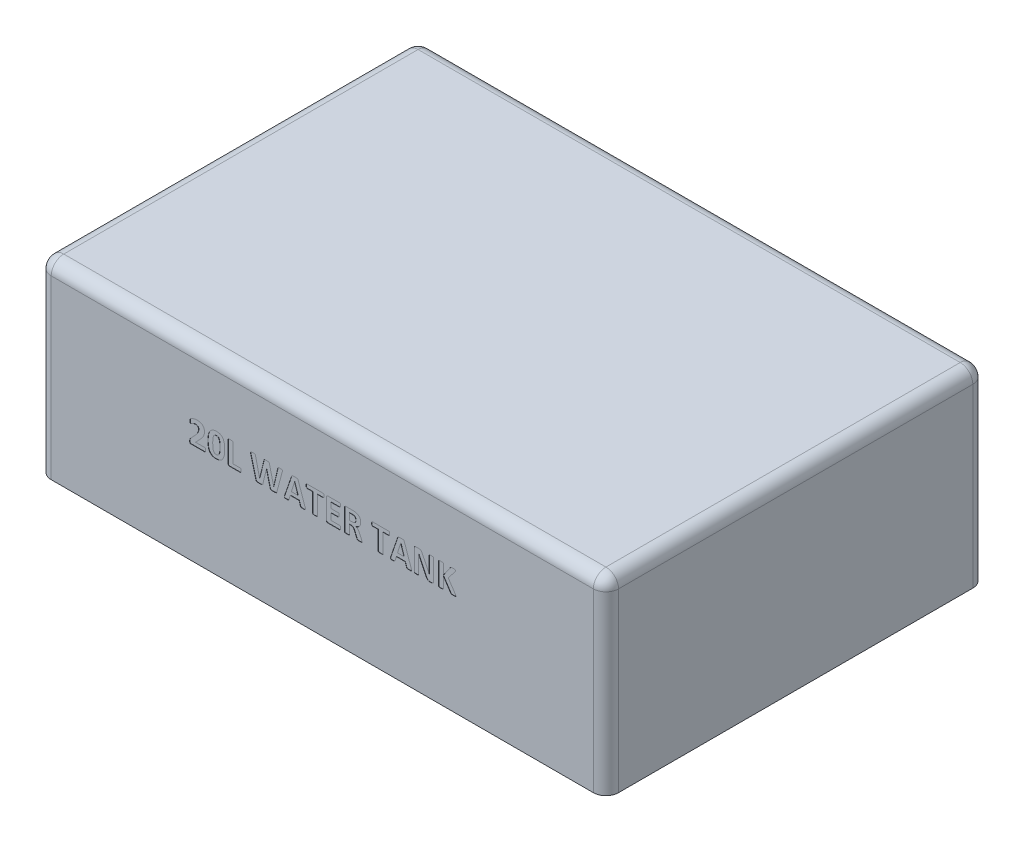
from build123d import *

# Parameters (mm, degrees)
SKETCH1_W           = 450
SKETCH1_H           = 300
BOSS_EXTRUDE1_DEPTH = 150
SKETCH6_W           = 450
SKETCH6_H           = 150
BOSS_EXTRUDE3_DEPTH = 1
CUT_EXTRUDE4_DEPTH  = 0.2
FILLET2_R           = 10


with BuildPart() as part:
    # Sketch1 → Boss-Extrude1 (new body)
    with BuildSketch(Plane(origin=(0, 0, 0), x_dir=(1, 0, 0), z_dir=(0, 1, 0))):
        Rectangle(SKETCH1_W, SKETCH1_H)
    extrude(amount=BOSS_EXTRUDE1_DEPTH)

    # Sketch6 → Boss-Extrude3 (add)
    with BuildSketch(Plane.XY.offset(150)):
        with Locations((0, 75)):
            Rectangle(SKETCH6_W, SKETCH6_H)
    extrude(amount=BOSS_EXTRUDE3_DEPTH)

    # Sketch7 → Cut-Extrude4 (cut)
    # profile 1 of 12: a face of its own
    with BuildSketch(Plane.XY.offset(151)):
        with BuildLine():
            add(Edge.make_bspline(
                [(-92.604166667, 81.506519991), (-92.60480363, 81.380135507), (-92.605979556, 81.146811364), (-92.638697416, 80.826192291), (-92.675039957, 80.559220559), (-92.73986537, 80.347915517), (-92.815393638, 80.181080844), (-92.92803015, 80.071795686), (-93.058861874, 80.014000144), (-93.149806715, 80.004696089), (-93.195709827, 80)],
                knots=[0, 0, 0, 0, 1.700477232, 3.139328327, 4.338937117, 5.31779253, 6.112293145, 6.774269824, 7.381330181, 8, 8, 8, 8], degree=3))
            Line((-93.195709827, 80), (-103.932856541, 80))
            add(Edge.make_bspline(
                [(-103.932856541, 80), (-104.032250538, 80.002068616), (-104.217935337, 80.005933142), (-104.477314553, 80.043518436), (-104.697058847, 80.128532112), (-104.875680521, 80.272830381), (-105.000659463, 80.488351757), (-105.083321584, 80.771882474), (-105.124010024, 81.135122808), (-105.129774354, 81.404304472), (-105.132965686, 81.553332759)],
                knots=[0, 0, 0, 0, 1.025949817, 1.916647791, 2.69162005, 3.43032923, 4.23901448, 5.220859075, 6.461371377, 8, 8, 8, 8], degree=3))
            add(Edge.make_bspline(
                [(-105.132965686, 81.553332759), (-105.129971468, 81.698053375), (-105.124445459, 81.965143951), (-105.098664553, 82.338663618), (-105.040258231, 82.660821638), (-104.944714973, 82.947984933), (-104.807070432, 83.207613385), (-104.646867855, 83.468762035), (-104.434825562, 83.730981757), (-104.274340433, 83.906274309), (-104.188198912, 84.000363817)],
                knots=[0, 0, 0, 0, 1.279770231, 2.361892714, 3.306414937, 4.167028953, 5.025172171, 5.898575693, 6.872045744, 8, 8, 8, 8], degree=3))
            Line((-104.188198912, 84.000363817), (-101.034720627, 87.387905944))
            add(Edge.make_bspline(
                [(-101.034720627, 87.387905944), (-100.884868047, 87.551649768), (-100.595086413, 87.868293986), (-100.190428172, 88.339630062), (-99.832953705, 88.789885379), (-99.520452452, 89.218089729), (-99.245262459, 89.625670122), (-99.005216501, 90.013970696), (-98.792782517, 90.383271425), (-98.561624321, 90.839819049), (-98.338219085, 91.376940413), (-98.163040733, 91.993368853), (-98.071254349, 92.565626764), (-98.057903293, 92.934232122), (-98.051470588, 93.111830767)],
                knots=[0, 0, 0, 0, 1.20947157, 2.338849612, 3.384319872, 4.341377303, 5.226828348, 6.063423144, 6.828539773, 7.547598628, 8.851019864, 9.991402106, 11.032232556, 12, 12, 12, 12], degree=3))
            add(Edge.make_bspline(
                [(-98.051470588, 93.111830767), (-98.059009048, 93.254418213), (-98.073942523, 93.536879897), (-98.187407947, 93.943130168), (-98.370232144, 94.316993078), (-98.635490272, 94.638780939), (-98.969198037, 94.91103637), (-99.383724506, 95.104957552), (-99.871215064, 95.232206245), (-100.222393746, 95.24542301), (-100.409131817, 95.25245098)],
                knots=[0, 0, 0, 0, 0.952592796, 1.887059298, 2.799298945, 3.716508085, 4.654435942, 5.655858967, 6.753510967, 8, 8, 8, 8], degree=3))
            add(Edge.make_bspline(
                [(-100.409131817, 95.25245098), (-100.545391142, 95.250045978), (-100.80996807, 95.245376147), (-101.195979847, 95.207899388), (-101.556838889, 95.138963349), (-101.996321619, 95.02183174), (-102.490632293, 94.838848551), (-103.016530166, 94.592635798), (-103.4610082, 94.34402625), (-103.781381682, 94.150744777), (-103.994583746, 94.010336466), (-104.133644618, 93.948853501), (-104.251549617, 93.899135174), (-104.328268537, 93.893260322), (-104.362682866, 93.890625)],
                knots=[0, 0, 0, 0, 1.155956231, 2.244538859, 3.28550842, 4.269318886, 6.100628768, 7.748195433, 9.191883973, 10.417953324, 10.925724687, 11.351067817, 11.708904068, 12, 12, 12, 12], degree=3))
            add(Edge.make_bspline(
                [(-104.362682866, 93.890625), (-104.403504868, 93.894276355), (-104.485725093, 93.901630607), (-104.59586215, 93.98044169), (-104.682019584, 94.107573093), (-104.742684534, 94.292851983), (-104.790475838, 94.538703348), (-104.833282912, 94.854048568), (-104.856579837, 95.24359789), (-104.859183038, 95.527623997), (-104.86060049, 95.682277305)],
                knots=[0, 0, 0, 0, 0.485692822, 0.97824142, 1.565816375, 2.311318477, 3.305989244, 4.581102635, 6.138397226, 8, 8, 8, 8], degree=3))
            add(Edge.make_bspline(
                [(-104.86060049, 95.682277305), (-104.86054146, 95.787298294), (-104.860434467, 95.977652661), (-104.841757483, 96.240239649), (-104.818675302, 96.45963364), (-104.780393041, 96.646504183), (-104.729079007, 96.806323981), (-104.661869136, 96.954985376), (-104.554003144, 97.103217089), (-104.431953606, 97.23712937), (-104.290188366, 97.355890492), (-104.141643896, 97.46013012), (-103.956490768, 97.576870997), (-103.641145757, 97.745785996), (-103.17475212, 97.972624358), (-102.526476842, 98.217840526), (-101.789417061, 98.444868039), (-100.979379016, 98.637294649), (-100.112645611, 98.770268656), (-99.515930316, 98.785482248), (-99.213278378, 98.793198529)],
                knots=[0, 0, 0, 0, 0.788292368, 1.428808632, 1.975788089, 2.443732868, 2.858052408, 3.234493626, 3.66294862, 4.228288178, 4.591069522, 5.049213324, 5.590039132, 6.233559628, 7.734267659, 9.480939635, 11.431700141, 13.521863135, 15.728704436, 18, 18, 18, 18], degree=3))
            add(Edge.make_bspline(
                [(-99.213278378, 98.793198529), (-98.977610285, 98.789755981), (-98.520821661, 98.783083389), (-97.857786595, 98.713361395), (-97.240454844, 98.601997991), (-96.670499213, 98.43769848), (-96.146527094, 98.238472427), (-95.665725916, 98.005318769), (-95.233852974, 97.731748046), (-94.847511238, 97.422991622), (-94.507193217, 97.083753717), (-94.211871692, 96.711578697), (-93.966876542, 96.307515424), (-93.765075455, 95.875241342), (-93.613698367, 95.418818539), (-93.503798304, 94.945851686), (-93.431658372, 94.456004188), (-93.424766738, 94.123528604), (-93.421262255, 93.954460593)],
                knots=[0, 0, 0, 0, 1.324900052, 2.568015312, 3.744666331, 4.8481595, 5.898614886, 6.894039723, 7.847934722, 8.767415271, 9.669989851, 10.544631889, 11.43259769, 12.321315746, 13.221949113, 14.131442766, 15.049815173, 16, 16, 16, 16], degree=3))
            add(Edge.make_bspline(
                [(-93.421262255, 93.954460593), (-93.429592097, 93.654726564), (-93.446209016, 93.056797367), (-93.554898838, 92.311952716), (-93.692128929, 91.714122645), (-93.851293196, 91.252514385), (-94.044779485, 90.769694979), (-94.296174737, 90.271894354), (-94.591766131, 89.748530912), (-94.94161458, 89.200523044), (-95.347110384, 88.626046651), (-95.811441118, 88.022539174), (-96.339573796, 87.378547151), (-96.944226184, 86.690212358), (-97.631126746, 85.955046569), (-98.120015693, 85.453466695), (-98.374904259, 85.19196155)],
                knots=[0, 0, 0, 0, 1.214695824, 2.423155294, 3.043825433, 3.698462194, 4.400034292, 5.150962269, 5.956941602, 6.835925221, 7.785176393, 8.806499493, 9.921972916, 11.160753287, 12.51972206, 14, 14, 14, 14], degree=3))
            Line((-98.374904259, 85.19196155), (-100.502757353, 82.996017157))
            Line((-100.502757353, 82.996017157), (-93.242522595, 82.996017157))
            add(Edge.make_bspline(
                [(-93.242522595, 82.996017157), (-93.196247126, 82.992092878), (-93.103322726, 82.984212649), (-92.974516492, 82.911857498), (-92.856312918, 82.804166794), (-92.763966629, 82.641598765), (-92.686272594, 82.434133457), (-92.641745976, 82.170385955), (-92.605279529, 81.856517384), (-92.604555067, 81.62867269), (-92.604166667, 81.506519991)],
                knots=[0, 0, 0, 0, 0.620001289, 1.24500623, 1.94939785, 2.757032326, 3.738367869, 4.928457297, 6.353276405, 8, 8, 8, 8], degree=3))
        make_face()
    # profile 2 of 12: a face of its own
    with BuildSketch(Plane.XY.offset(151)):
        with BuildLine():
            add(Edge.make_bspline(
                [(-77.351715686, 89.332763672), (-77.355292965, 88.973756866), (-77.362270577, 88.273500919), (-77.431284596, 87.249337534), (-77.545945492, 86.279369886), (-77.700262262, 85.363163277), (-77.905193429, 84.504751616), (-78.173994756, 83.710275145), (-78.496418658, 82.979617457), (-78.874075313, 82.314277265), (-79.316830133, 81.722183454), (-79.815502961, 81.196394958), (-80.384155335, 80.752154024), (-81.011625843, 80.376813691), (-81.706844942, 80.081514131), (-82.475375734, 79.873350349), (-83.315714406, 79.751278445), (-83.900832017, 79.735693795), (-84.20340265, 79.727634804)],
                knots=[0, 0, 0, 0, 1.280142505, 2.496964928, 3.658445283, 4.762089533, 5.808699902, 6.802158264, 7.748814871, 8.653008089, 9.524146816, 10.379274413, 11.229404425, 12.089188086, 12.979964829, 13.913938538, 14.921275101, 16, 16, 16, 16], degree=3))
            add(Edge.make_bspline(
                [(-84.20340265, 79.727634804), (-84.510195366, 79.735875353), (-85.097899508, 79.751661272), (-85.939739459, 79.868863928), (-86.697845504, 80.071662404), (-87.376638972, 80.354954444), (-87.981549863, 80.714892767), (-88.510399241, 81.156720942), (-88.987946277, 81.656352866), (-89.386203493, 82.239463811), (-89.728147099, 82.887088926), (-90.01007163, 83.602046907), (-90.247618215, 84.380899002), (-90.415484614, 85.228624944), (-90.539929366, 86.137245137), (-90.633585446, 87.102580073), (-90.689385003, 88.12631361), (-90.694818416, 88.827681984), (-90.697610294, 89.188069661)],
                knots=[0, 0, 0, 0, 1.116564975, 2.138935591, 3.085931557, 3.965362537, 4.808430945, 5.637530691, 6.466775146, 7.316224023, 8.198621357, 9.127780993, 10.109559384, 11.158728965, 12.269463774, 13.447127443, 14.688244517, 16, 16, 16, 16], degree=3))
            add(Edge.make_bspline(
                [(-90.697610294, 89.188069661), (-90.694745775, 89.545717375), (-90.68915818, 90.243352799), (-90.610169514, 91.263787968), (-90.50636612, 92.233728006), (-90.3440321, 93.150667505), (-90.134530905, 94.011065427), (-89.868906891, 94.80850502), (-89.543395423, 95.538047612), (-89.165306174, 96.20254439), (-88.725629828, 96.799879671), (-88.220833316, 97.322897618), (-87.652674166, 97.768935645), (-87.024854916, 98.143930422), (-86.329745929, 98.439414298), (-85.563850692, 98.646438267), (-84.728034588, 98.769979319), (-84.147098815, 98.785270894), (-83.84592333, 98.793198529)],
                knots=[0, 0, 0, 0, 1.275935792, 2.488868156, 3.650539398, 4.755790181, 5.809222936, 6.808140458, 7.750805295, 8.655602092, 9.531384403, 10.390594486, 11.241291987, 12.101649582, 12.993020947, 13.927618113, 14.925611662, 16, 16, 16, 16], degree=3))
            add(Edge.make_bspline(
                [(-83.84592333, 98.793198529), (-83.538998324, 98.787388301), (-82.949374852, 98.776226464), (-82.107955801, 98.64915571), (-81.344376034, 98.455301876), (-80.665024706, 98.164980258), (-80.057153717, 97.805398433), (-79.519129901, 97.371404846), (-79.050690211, 96.862591519), (-78.649626301, 96.281964585), (-78.309237426, 95.633389337), (-78.024056741, 94.920383678), (-77.800295496, 94.138224087), (-77.629035222, 93.292446228), (-77.503981637, 92.383778056), (-77.417291267, 91.417987754), (-77.359516446, 90.394555662), (-77.354363467, 89.693163547), (-77.351715686, 89.332763672)],
                knots=[0, 0, 0, 0, 1.1154279, 2.142811628, 3.087698179, 3.973172265, 4.819981724, 5.64914424, 6.477969577, 7.326725871, 8.20840376, 9.136805822, 10.114848545, 11.163162705, 12.272991897, 13.449208879, 14.689314032, 16, 16, 16, 16], degree=3))
        make_face()
        with BuildLine():
            add(Edge.make_bspline(
                [(-81.164828431, 89.141256893), (-81.165742861, 89.352623595), (-81.167510528, 89.761212792), (-81.178307669, 90.355825717), (-81.206660042, 90.910318846), (-81.233261497, 91.429983022), (-81.276886576, 91.913733181), (-81.327717667, 92.36495737), (-81.384932223, 92.782943722), (-81.481111837, 93.277651617), (-81.605933458, 93.829392363), (-81.815951397, 94.401705936), (-82.056906927, 94.876283264), (-82.364218689, 95.238388715), (-82.709223363, 95.513982536), (-83.107339291, 95.683254044), (-83.541425805, 95.784083369), (-83.845319639, 95.79269973), (-84.003384459, 95.797181373)],
                knots=[0, 0, 0, 0, 1.252656067, 2.421487074, 3.523945301, 4.542880805, 5.504947389, 6.401770782, 7.23401126, 8.00401156, 9.388497809, 10.580084833, 11.61067594, 12.523473101, 13.374357542, 14.202341007, 15.064980546, 16, 16, 16, 16], degree=3))
            add(Edge.make_bspline(
                [(-84.003384459, 95.797181373), (-84.140033892, 95.792911757), (-84.402898354, 95.784698549), (-84.777778415, 95.704244033), (-85.120511459, 95.584616676), (-85.421453935, 95.40006151), (-85.692464032, 95.170745968), (-85.924437945, 94.884291929), (-86.135529061, 94.554304064), (-86.312613832, 94.172816043), (-86.459643798, 93.742399675), (-86.587551592, 93.264905251), (-86.688224038, 92.735689916), (-86.762575604, 92.157098739), (-86.816885772, 91.529434575), (-86.853080461, 90.852368547), (-86.88032982, 90.125960888), (-86.883079994, 89.625016949), (-86.884497549, 89.366809321)],
                knots=[0, 0, 0, 0, 0.830406459, 1.597403976, 2.323929485, 3.028688112, 3.73286484, 4.474568648, 5.262512747, 6.112128818, 7.026802286, 8.027809387, 9.118195914, 10.302553145, 11.576589742, 12.951469302, 14.428658737, 16, 16, 16, 16], degree=3))
            add(Edge.make_bspline(
                [(-86.884497549, 89.366809321), (-86.883293608, 89.054704452), (-86.88099455, 88.458705881), (-86.852169577, 87.607101342), (-86.800237543, 86.839495639), (-86.736576795, 86.1515182), (-86.642220867, 85.539465533), (-86.528949417, 84.99614519), (-86.393887501, 84.517748096), (-86.239267302, 84.100875626), (-86.055031669, 83.745983289), (-85.845975441, 83.449449415), (-85.614619068, 83.20485095), (-85.354266209, 83.017767013), (-85.065476697, 82.884753604), (-84.753813414, 82.794271166), (-84.417381062, 82.729813991), (-84.183872838, 82.725754124), (-84.062964346, 82.723651961)],
                knots=[0, 0, 0, 0, 1.85321902, 3.538925519, 5.058498589, 6.421342315, 7.640056482, 8.733733654, 9.714903156, 10.58939389, 11.369318339, 12.082176755, 12.737469836, 13.359260972, 13.973474606, 14.615698241, 15.283220796, 16, 16, 16, 16], degree=3))
            add(Edge.make_bspline(
                [(-84.062964346, 82.723651961), (-83.884695592, 82.730518513), (-83.543958733, 82.74364301), (-83.063129909, 82.87950322), (-82.642482767, 83.104182512), (-82.285070571, 83.428875398), (-81.981409903, 83.837589547), (-81.740720751, 84.341307026), (-81.544692473, 84.92518079), (-81.388517279, 85.595019581), (-81.275800215, 86.352144808), (-81.207921605, 87.200934629), (-81.171723412, 88.140832104), (-81.167194661, 88.7979296), (-81.164828431, 89.141256893)],
                knots=[0, 0, 0, 0, 0.812198358, 1.552408438, 2.25954763, 2.970620909, 3.738781613, 4.570097942, 5.508197261, 6.546623335, 7.706294858, 8.999891258, 10.432471252, 12, 12, 12, 12], degree=3))
        make_face(mode=Mode.SUBTRACT)
    # profile 3 of 12: a face of its own
    with BuildSketch(Plane.XY.offset(151)):
        with BuildLine():
            add(Edge.make_bspline(
                [(-64.278186275, 81.519287109), (-64.278928563, 81.392928103), (-64.280298936, 81.159650998), (-64.311523415, 80.841525222), (-64.350992457, 80.576816769), (-64.413246568, 80.364508761), (-64.491276754, 80.1958832), (-64.595399097, 80.077098321), (-64.724651742, 80.012562427), (-64.815182668, 80.004234689), (-64.861218022, 80)],
                knots=[0, 0, 0, 0, 1.69995762, 3.138369049, 4.299922826, 5.296754232, 6.108045987, 6.783725302, 7.381519227, 8, 8, 8, 8], degree=3))
            Line((-64.861218022, 80), (-73.491790173, 80))
            add(Edge.make_bspline(
                [(-73.491790173, 80), (-73.568615033, 80.0032405), (-73.718394128, 80.009558236), (-73.934904204, 80.059654879), (-74.127985618, 80.153637203), (-74.307757038, 80.270458327), (-74.455919353, 80.435785373), (-74.559529412, 80.648941463), (-74.616311729, 80.903547957), (-74.62399636, 81.086338095), (-74.628063725, 81.18308632)],
                knots=[0, 0, 0, 0, 0.988206998, 1.926625728, 2.832905899, 3.739002297, 4.669579943, 5.648984647, 6.755640938, 8, 8, 8, 8], degree=3))
            Line((-74.628063725, 81.18308632), (-74.628063725, 97.920778761))
            add(Edge.make_bspline(
                [(-74.628063725, 97.920778761), (-74.62272286, 97.967100087), (-74.612091754, 98.059303664), (-74.535227222, 98.188450752), (-74.404385379, 98.298572281), (-74.205950491, 98.374395286), (-73.946906337, 98.435580675), (-73.61245543, 98.485957606), (-73.195982104, 98.519472102), (-72.888979782, 98.520352868), (-72.721507353, 98.520833333)],
                knots=[0, 0, 0, 0, 0.51358715, 1.022306066, 1.626293916, 2.38232859, 3.357940148, 4.587254232, 6.138317588, 8, 8, 8, 8], degree=3))
            add(Edge.make_bspline(
                [(-72.721507353, 98.520833333), (-72.551180005, 98.520517817), (-72.242723106, 98.519946427), (-71.82499355, 98.485464964), (-71.492986428, 98.436381491), (-71.236069347, 98.373541498), (-71.037971296, 98.298945463), (-70.90901023, 98.187062643), (-70.824774649, 98.061023365), (-70.818213168, 97.967350382), (-70.81495098, 97.920778761)],
                knots=[0, 0, 0, 0, 1.891840835, 3.426057895, 4.654471675, 5.614083843, 6.369564826, 6.973110337, 7.489458814, 8, 8, 8, 8], degree=3))
            Line((-70.81495098, 97.920778761), (-70.81495098, 82.996017157))
            Line((-70.81495098, 82.996017157), (-64.861218022, 82.996017157))
            add(Edge.make_bspline(
                [(-64.861218022, 82.996017157), (-64.814928523, 82.993901019), (-64.724983755, 82.989789168), (-64.60195438, 82.921318098), (-64.495984801, 82.815558922), (-64.418062977, 82.656654627), (-64.347502446, 82.454855803), (-64.31287561, 82.193846489), (-64.279732417, 81.877640544), (-64.278731658, 81.645692149), (-64.278186275, 81.519287109)],
                knots=[0, 0, 0, 0, 0.628853991, 1.221921344, 1.883771067, 2.660348459, 3.628496149, 4.814630856, 6.264067687, 8, 8, 8, 8], degree=3))
        make_face()
    # profile 4 of 12: a face of its own
    with BuildSketch(Plane.XY.offset(151)):
        with BuildLine():
            add(Edge.make_bspline(
                [(-36.016041475, 81.034136604), (-36.046561685, 80.930851948), (-36.102821938, 80.740459392), (-36.23510775, 80.484073628), (-36.43844476, 80.292549453), (-36.712589829, 80.160888965), (-37.061592029, 80.077395308), (-37.496868644, 80.024527729), (-38.037318327, 80.004625082), (-38.434703222, 80.001647512), (-38.654579312, 80)],
                knots=[0, 0, 0, 0, 0.828472167, 1.527186518, 2.191185698, 2.938119969, 3.840992575, 4.941785944, 6.307866865, 8, 8, 8, 8], degree=3))
            add(Edge.make_bspline(
                [(-38.654579312, 80), (-38.782241915, 80.001684512), (-39.024802525, 80.004885107), (-39.369707642, 80.005340504), (-39.674510812, 80.021572671), (-40.011949862, 80.033085384), (-40.361173991, 80.076838268), (-40.708344999, 80.158305418), (-40.970436474, 80.291552018), (-41.151284466, 80.487834362), (-41.265022888, 80.742203329), (-41.310726351, 80.931051336), (-41.335674211, 81.034136604)],
                knots=[0, 0, 0, 0, 1.200390798, 2.280758157, 3.241844714, 4.069696988, 5.454290943, 6.544491945, 7.409847109, 8.174247725, 9.003388151, 10, 10, 10, 10], degree=3))
            Line((-41.335674211, 81.034136604), (-44.229554419, 92.664981618))
            Line((-44.229554419, 92.664981618), (-44.259344363, 92.664981618))
            Line((-44.259344363, 92.664981618), (-47.123434628, 81.034136604))
            add(Edge.make_bspline(
                [(-47.123434628, 81.034136604), (-47.148328165, 80.935140152), (-47.194916855, 80.749866561), (-47.313944152, 80.501375051), (-47.492483014, 80.298553441), (-47.756955017, 80.164614386), (-48.101096853, 80.074727993), (-48.448667581, 80.033252448), (-48.781744435, 80.021719378), (-49.083725866, 80.005167488), (-49.424376087, 80.004951697), (-49.665518204, 80.001701541), (-49.791762408, 80)],
                knots=[0, 0, 0, 0, 0.964606664, 1.805278237, 2.584746217, 3.474186178, 4.562364076, 5.943010412, 6.776466711, 7.71722888, 8.804909628, 10, 10, 10, 10], degree=3))
            add(Edge.make_bspline(
                [(-49.791762408, 80), (-49.925099633, 80.001682929), (-50.176172674, 80.004851873), (-50.532417849, 80.00535816), (-50.845745678, 80.021609065), (-51.191639705, 80.032994562), (-51.548177207, 80.076129056), (-51.901421589, 80.159654763), (-52.170188548, 80.290131148), (-52.356698698, 80.487272292), (-52.473489636, 80.742969753), (-52.528101732, 80.931190564), (-52.557971431, 81.034136604)],
                knots=[0, 0, 0, 0, 1.226427643, 2.309354474, 3.275578471, 4.111462609, 5.491790153, 6.570859358, 7.440377765, 8.197066898, 9.013898509, 10, 10, 10, 10], degree=3))
            Line((-52.557971431, 81.034136604), (-56.788143382, 97.044103286))
            add(Edge.make_bspline(
                [(-56.788143382, 97.044103286), (-56.80698719, 97.124874479), (-56.842265984, 97.276091803), (-56.885951247, 97.490152842), (-56.915059731, 97.676456824), (-56.941436471, 97.877309795), (-56.924657882, 98.101351755), (-56.798366711, 98.274744732), (-56.661090362, 98.371957046), (-56.524509773, 98.42335023), (-56.361485271, 98.46217032), (-56.168726469, 98.48536373), (-55.940038745, 98.501086209), (-55.673304078, 98.515011677), (-55.366722317, 98.516112539), (-55.149690523, 98.519199222), (-55.034792433, 98.520833333)],
                knots=[0, 0, 0, 0, 1.131713364, 2.118758674, 2.981202209, 3.70160486, 4.892526967, 5.934423668, 6.503746327, 7.172352893, 7.90946648, 8.788265191, 9.817133147, 11.038040768, 12.431918871, 14, 14, 14, 14], degree=3))
            add(Edge.make_bspline(
                [(-55.034792433, 98.520833333), (-54.928399124, 98.521104737), (-54.72553212, 98.521622241), (-54.440348743, 98.518188162), (-54.189272705, 98.508213238), (-53.918059883, 98.498959841), (-53.6426991, 98.480478853), (-53.384078712, 98.411728826), (-53.194264072, 98.320175069), (-53.076257264, 98.17054551), (-53.018204363, 97.976086464), (-52.990567917, 97.83444014), (-52.975030637, 97.754806219)],
                knots=[0, 0, 0, 0, 1.288700235, 2.457248118, 3.454435296, 4.331425027, 5.747093502, 6.780913502, 7.565316964, 8.249610182, 9.015926434, 10, 10, 10, 10], degree=3))
            Line((-52.975030637, 97.754806219), (-49.706648284, 83.702464384))
            Line((-49.706648284, 83.702464384), (-49.693881166, 83.702464384))
            Line((-49.693881166, 83.702464384), (-46.246759153, 97.656924977))
            add(Edge.make_bspline(
                [(-46.246759153, 97.656924977), (-46.227594149, 97.738285056), (-46.192119319, 97.888884292), (-46.110751655, 98.095780331), (-45.972530269, 98.258785957), (-45.767968281, 98.371085334), (-45.498499603, 98.448857471), (-45.223218969, 98.479672197), (-44.958944668, 98.501292064), (-44.717701669, 98.514824146), (-44.443745362, 98.51616707), (-44.250827668, 98.519218101), (-44.148696002, 98.520833333)],
                knots=[0, 0, 0, 0, 0.991997648, 1.836208739, 2.612054163, 3.472220261, 4.563607158, 5.922711611, 6.750146941, 7.710810409, 8.788090707, 10, 10, 10, 10], degree=3))
            add(Edge.make_bspline(
                [(-44.148696002, 98.520833333), (-44.040870621, 98.521713874), (-43.83511003, 98.523394187), (-43.545812432, 98.512223353), (-43.290301057, 98.505487946), (-43.011836823, 98.489241686), (-42.723932078, 98.462508488), (-42.444563018, 98.388106726), (-42.234064945, 98.277249286), (-42.09937225, 98.107775619), (-42.008631789, 97.898867137), (-41.972607245, 97.742893125), (-41.952751608, 97.656924977)],
                knots=[0, 0, 0, 0, 1.228277533, 2.343892593, 3.297971527, 4.139769378, 5.522974951, 6.58189546, 7.42182955, 8.179183829, 8.996421316, 10, 10, 10, 10], degree=3))
            Line((-41.952751608, 97.656924977), (-38.539675245, 83.702464384))
            Line((-38.539675245, 83.702464384), (-38.509885302, 83.702464384))
            Line((-38.509885302, 83.702464384), (-35.271292892, 97.712249157))
            add(Edge.make_bspline(
                [(-35.271292892, 97.712249157), (-35.255261538, 97.781991255), (-35.225057774, 97.913388382), (-35.165849889, 98.100655067), (-35.055920129, 98.263951072), (-34.863918999, 98.370167569), (-34.609229373, 98.451291795), (-34.339845613, 98.479505058), (-34.075728746, 98.501527635), (-33.828754129, 98.514912176), (-33.543466879, 98.51615754), (-33.340616805, 98.519210696), (-33.232809628, 98.520833333)],
                knots=[0, 0, 0, 0, 0.875411882, 1.649313821, 2.395684222, 3.214212243, 4.273299352, 5.657392683, 6.510506289, 7.518311766, 8.681076133, 10, 10, 10, 10], degree=3))
            add(Edge.make_bspline(
                [(-33.232809628, 98.520833333), (-33.132096176, 98.519202102), (-32.942014872, 98.516123403), (-32.673733582, 98.514985929), (-32.440961815, 98.501214198), (-32.194090137, 98.48123545), (-31.943575476, 98.442759393), (-31.708519422, 98.311514781), (-31.576857896, 98.090055599), (-31.575291285, 97.864298635), (-31.598628744, 97.656556912), (-31.62790296, 97.462784285), (-31.677737478, 97.24263142), (-31.712207732, 97.085263422), (-31.730545343, 97.001546224)],
                knots=[0, 0, 0, 0, 1.252588424, 2.364069893, 3.33573087, 4.150248658, 5.447623475, 6.461137435, 7.386877247, 8.501713295, 9.193295655, 9.996657773, 10.934254751, 12, 12, 12, 12], degree=3))
            Line((-31.730545343, 97.001546224), (-36.016041475, 81.034136604))
        make_face()
    # profile 5 of 12: a face of its own
    with BuildSketch(Plane.XY.offset(151)):
        with BuildLine():
            add(Edge.make_bspline(
                [(-13.482077206, 81.476730047), (-13.454137044, 81.39617799), (-13.402051434, 81.246014114), (-13.342974755, 81.029228643), (-13.295655097, 80.84083458), (-13.263396946, 80.676557285), (-13.251262136, 80.534287065), (-13.269225834, 80.411583687), (-13.305879329, 80.303170758), (-13.378505934, 80.216219856), (-13.476163474, 80.14535866), (-13.605851297, 80.097001473), (-13.76195798, 80.05355816), (-13.951054185, 80.030555881), (-14.172895773, 80.021396298), (-14.429493264, 80.00533257), (-14.726185758, 80.004843458), (-14.936119276, 80.001685596), (-15.048177083, 80)],
                knots=[0, 0, 0, 0, 1.351975101, 2.52033068, 3.562719996, 4.432170766, 5.176088948, 5.812532786, 6.389296298, 6.965620705, 7.577732788, 8.283941723, 9.146375963, 10.145613058, 11.295182858, 12.669444765, 14.222224263, 16, 16, 16, 16], degree=3))
            add(Edge.make_bspline(
                [(-15.048177083, 80), (-15.163079621, 79.999726467), (-15.380127599, 79.99920977), (-15.685194422, 80.002598782), (-15.950374932, 80.012800054), (-16.234681053, 80.020592977), (-16.519506598, 80.047697817), (-16.793384432, 80.092380208), (-16.989929388, 80.167233919), (-17.123790347, 80.277632666), (-17.200204274, 80.423644326), (-17.23705424, 80.527260651), (-17.256888595, 80.583031748)],
                knots=[0, 0, 0, 0, 1.402041787, 2.648421349, 3.722147351, 4.640185661, 6.117966101, 7.211050041, 8.017924191, 8.656254393, 9.276733986, 10, 10, 10, 10], degree=3))
            Line((-17.256888595, 80.583031748), (-18.388906441, 84.085477941))
            Line((-18.388906441, 84.085477941), (-25.376776003, 84.085477941))
            Line((-25.376776003, 84.085477941), (-26.449213963, 80.68091299))
            add(Edge.make_bspline(
                [(-26.449213963, 80.68091299), (-26.468623216, 80.619299115), (-26.505584095, 80.501968324), (-26.589513723, 80.339906529), (-26.724693022, 80.2121077), (-26.915288817, 80.116157318), (-27.178506642, 80.058572574), (-27.523122406, 80.01670215), (-27.969939144, 80.007188431), (-28.30190513, 80.002579494), (-28.487697227, 80)],
                knots=[0, 0, 0, 0, 0.662368552, 1.261342941, 1.847645799, 2.537239812, 3.42265718, 4.595262896, 6.094463672, 8, 8, 8, 8], degree=3))
            add(Edge.make_bspline(
                [(-28.487697227, 80), (-28.591257414, 80.001067673), (-28.787063712, 80.003086375), (-29.063765606, 80.011259224), (-29.304956318, 80.024167684), (-29.512850438, 80.038576618), (-29.687199941, 80.066801092), (-29.833818971, 80.109754146), (-29.952353458, 80.166322876), (-30.074355042, 80.266075382), (-30.155266347, 80.459444398), (-30.145873881, 80.743802011), (-30.056029661, 81.096186208), (-29.973110493, 81.358107345), (-29.926125919, 81.506519991)],
                knots=[0, 0, 0, 0, 1.279822224, 2.419822313, 3.420424811, 4.264789446, 4.993926375, 5.598399463, 6.14718048, 6.607326483, 7.517039103, 8.604050794, 10.075749779, 12, 12, 12, 12], degree=3))
            Line((-29.926125919, 81.506519991), (-24.325616575, 97.784596163))
            add(Edge.make_bspline(
                [(-24.325616575, 97.784596163), (-24.296353983, 97.857758709), (-24.24224003, 97.993054815), (-24.134442435, 98.177762157), (-23.972732697, 98.322026447), (-23.737499672, 98.411111472), (-23.429966424, 98.4785144), (-23.113068088, 98.499111744), (-22.807783326, 98.5081819), (-22.531184986, 98.51801335), (-22.21905329, 98.521678513), (-21.999164399, 98.52112575), (-21.882841222, 98.520833333)],
                knots=[0, 0, 0, 0, 0.856868194, 1.584566637, 2.305859304, 3.162727498, 4.285524966, 5.725550839, 6.605441018, 7.608682037, 8.734971556, 10, 10, 10, 10], degree=3))
            add(Edge.make_bspline(
                [(-21.882841222, 98.520833333), (-21.749495254, 98.521113609), (-21.495562139, 98.521647343), (-21.13662402, 98.518091621), (-20.820294998, 98.508281797), (-20.475350138, 98.498952705), (-20.12176547, 98.479331608), (-19.778563794, 98.411431968), (-19.520134098, 98.320610441), (-19.340064658, 98.169869046), (-19.222981739, 97.971079846), (-19.17058358, 97.822576863), (-19.142166437, 97.742039101)],
                knots=[0, 0, 0, 0, 1.298203691, 2.47219252, 3.494555852, 4.378870695, 5.833194716, 6.932857721, 7.781737059, 8.467837287, 9.169060755, 10, 10, 10, 10], degree=3))
            Line((-19.142166437, 97.742039101), (-13.482077206, 81.476730047))
        make_face()
        Polygon((-21.925398284, 95.060944202), (-21.938165403, 95.060944202), (-24.436264936, 87.081495098), (-19.354951746, 87.081495098), align=None, mode=Mode.SUBTRACT)
    # profile 6 of 12: a face of its own
    with BuildSketch(Plane.XY.offset(151)):
        with BuildLine():
            add(Edge.make_bspline(
                [(1.36182598, 97.014313343), (1.361161429, 96.889352522), (1.3599357, 96.658869168), (1.32776998, 96.343810904), (1.290611649, 96.082652803), (1.22604138, 95.877375263), (1.152305431, 95.715265522), (1.052562502, 95.603838963), (0.933103053, 95.537109369), (0.84767336, 95.528954005), (0.80432847, 95.524816176)],
                knots=[0, 0, 0, 0, 1.727489177, 3.186258664, 4.380030672, 5.366980201, 6.156890973, 6.823580194, 7.403113996, 8, 8, 8, 8], degree=3))
            Line((0.80432847, 95.524816176), (-3.813112745, 95.524816176))
            Line((-3.813112745, 95.524816176), (-3.813112745, 80.600054573))
            add(Edge.make_bspline(
                [(-3.813112745, 80.600054573), (-3.81689907, 80.555170151), (-3.824738786, 80.462235398), (-3.904265704, 80.333948781), (-4.039085589, 80.227719524), (-4.233701281, 80.144494703), (-4.496000031, 80.085816566), (-4.82989475, 80.033958576), (-5.246924337, 80.008171778), (-5.552260965, 80.002893786), (-5.719669118, 80)],
                knots=[0, 0, 0, 0, 0.495428615, 1.025802158, 1.619721617, 2.382290446, 3.358084909, 4.603221316, 6.137634369, 8, 8, 8, 8], degree=3))
            add(Edge.make_bspline(
                [(-5.719669118, 80), (-5.887062927, 80.002993358), (-6.193787887, 80.008478253), (-6.610990228, 80.033235796), (-6.944590481, 80.0863308), (-7.205891575, 80.144341409), (-7.399602164, 80.228045764), (-7.536273502, 80.332640143), (-7.608418763, 80.463918397), (-7.620385213, 80.555404423), (-7.62622549, 80.600054573)],
                knots=[0, 0, 0, 0, 1.863507167, 3.414607538, 4.64490574, 5.621298315, 6.38433456, 6.978618062, 7.501510141, 8, 8, 8, 8], degree=3))
            Line((-7.62622549, 80.600054573), (-7.62622549, 95.524816176))
            Line((-7.62622549, 95.524816176), (-12.243666705, 95.524816176))
            add(Edge.make_bspline(
                [(-12.243666705, 95.524816176), (-12.28818552, 95.529145332), (-12.375824064, 95.53766759), (-12.500101763, 95.599792193), (-12.589486202, 95.720055449), (-12.673000907, 95.874468778), (-12.726023634, 96.084612841), (-12.775360748, 96.342618065), (-12.796562641, 96.65938674), (-12.799545909, 96.889490859), (-12.801164216, 97.014313343)],
                knots=[0, 0, 0, 0, 0.615041605, 1.210754367, 1.850260391, 2.647570539, 3.626916286, 4.821718098, 6.275906385, 8, 8, 8, 8], degree=3))
            add(Edge.make_bspline(
                [(-12.801164216, 97.014313343), (-12.799592173, 97.143396622), (-12.796703447, 97.380595047), (-12.775087324, 97.707182495), (-12.726856237, 97.971101801), (-12.673782253, 98.182833319), (-12.589862533, 98.334925345), (-12.498552321, 98.449861808), (-12.376301455, 98.513354104), (-12.288279445, 98.518317636), (-12.243666705, 98.520833333)],
                knots=[0, 0, 0, 0, 1.76052633, 3.235074862, 4.452992343, 5.420080963, 6.190359611, 6.807177194, 7.395434236, 8, 8, 8, 8], degree=3))
            Line((-12.243666705, 98.520833333), (0.80432847, 98.520833333))
            add(Edge.make_bspline(
                [(0.80432847, 98.520833333), (0.846354334, 98.518354576), (0.930772256, 98.513375462), (1.046973961, 98.444515119), (1.152947073, 98.34152438), (1.226559975, 98.179560057), (1.291630162, 97.973222984), (1.327400734, 97.705945646), (1.360125096, 97.381126763), (1.36122676, 97.143541371), (1.36182598, 97.014313343)],
                knots=[0, 0, 0, 0, 0.567698481, 1.1403436, 1.798537057, 2.561762834, 3.536980895, 4.75483643, 6.234882676, 8, 8, 8, 8], degree=3))
        make_face()
    # profile 7 of 12: a face of its own
    with BuildSketch(Plane.XY.offset(151)):
        with BuildLine():
            add(Edge.make_bspline(
                [(14.435355392, 81.498008578), (14.434743833, 81.368799353), (14.433626172, 81.132662007), (14.401645386, 80.811812309), (14.364181459, 80.550842458), (14.301005055, 80.346719917), (14.220108602, 80.189212656), (14.1174467, 80.078505019), (13.996139489, 80.013739122), (13.911144022, 80.004529127), (13.869346469, 80)],
                knots=[0, 0, 0, 0, 1.772437912, 3.239232977, 4.423707261, 5.384401224, 6.159891517, 6.834724464, 7.426961607, 8, 8, 8, 8], degree=3))
            Line((13.869346469, 80), (4.404655905, 80))
            add(Edge.make_bspline(
                [(4.404655905, 80), (4.327830144, 80.003240093), (4.178049289, 80.009557036), (3.961551754, 80.059659335), (3.768424769, 80.153621104), (3.588823955, 80.270519182), (3.439132006, 80.436504725), (3.338808577, 80.651119234), (3.279044896, 80.906097297), (3.272107312, 81.089089198), (3.268382353, 81.187342027)],
                knots=[0, 0, 0, 0, 0.986134925, 1.922585978, 2.82696586, 3.731162354, 4.659788764, 5.653462416, 6.740086574, 8, 8, 8, 8], degree=3))
            Line((3.268382353, 81.187342027), (3.268382353, 97.333491307))
            add(Edge.make_bspline(
                [(3.268382353, 97.333491307), (3.272183295, 97.4317153), (3.279262395, 97.614653498), (3.337814453, 97.868734534), (3.440233754, 98.081162892), (3.590098451, 98.245463423), (3.767849755, 98.369111595), (3.965037083, 98.459920252), (4.183561002, 98.511869707), (4.334868685, 98.517776624), (4.413167318, 98.520833333)],
                knots=[0, 0, 0, 0, 1.255398639, 2.338128977, 3.311977815, 4.237276575, 5.148590167, 6.066205518, 6.999300883, 8, 8, 8, 8], degree=3))
            Line((4.413167318, 98.520833333), (13.877857881, 98.520833333))
            add(Edge.make_bspline(
                [(13.877857881, 98.520833333), (13.919628192, 98.517936438), (14.002875341, 98.512162999), (14.11990001, 98.452091264), (14.220428329, 98.343611452), (14.294977812, 98.181064208), (14.365435893, 97.972287448), (14.400757651, 97.705922139), (14.43414338, 97.381170786), (14.434924036, 97.142137216), (14.435355392, 97.010057636)],
                knots=[0, 0, 0, 0, 0.566414176, 1.128848811, 1.744661206, 2.549421896, 3.546753268, 4.742756138, 6.200188366, 8, 8, 8, 8], degree=3))
            add(Edge.make_bspline(
                [(14.435355392, 97.010057636), (14.43479449, 96.883667206), (14.433765257, 96.65174562), (14.400798108, 96.335373933), (14.365671467, 96.074835176), (14.29649052, 95.8717375), (14.215188374, 95.717219205), (14.122021124, 95.602493568), (14.003393788, 95.538048825), (13.919655002, 95.529221981), (13.877857881, 95.524816176)],
                knots=[0, 0, 0, 0, 1.754513308, 3.219464557, 4.418295359, 5.396805865, 6.181695552, 6.838026381, 7.420016048, 8, 8, 8, 8], degree=3))
            Line((13.877857881, 95.524816176), (7.081495098, 95.524816176))
            Line((7.081495098, 95.524816176), (7.081495098, 91.166973039))
            Line((7.081495098, 91.166973039), (12.775629979, 91.166973039))
            add(Edge.make_bspline(
                [(12.775629979, 91.166973039), (12.819124651, 91.163020869), (12.906790544, 91.155055054), (13.02524154, 91.083209042), (13.132370857, 90.978277629), (13.211043463, 90.819733139), (13.276000652, 90.61368023), (13.311149938, 90.349254411), (13.344418409, 90.025860591), (13.345372532, 89.789683837), (13.345894608, 89.660453048)],
                knots=[0, 0, 0, 0, 0.588344271, 1.185840062, 1.842418932, 2.6128118, 3.567190965, 4.782059029, 6.239212611, 8, 8, 8, 8], degree=3))
            add(Edge.make_bspline(
                [(13.345894608, 89.660453048), (13.345242074, 89.52983432), (13.344048338, 89.290882038), (13.312564694, 88.967097977), (13.274462935, 88.704884029), (13.212570034, 88.501554296), (13.130546748, 88.347048397), (13.027697362, 88.240361218), (12.904703221, 88.179586028), (12.818796469, 88.173842097), (12.775629979, 88.170955882)],
                knots=[0, 0, 0, 0, 1.788442105, 3.271753817, 4.453938487, 5.412775407, 6.169742938, 6.829388584, 7.411790278, 8, 8, 8, 8], degree=3))
            Line((12.775629979, 88.170955882), (7.081495098, 88.170955882))
            Line((7.081495098, 88.170955882), (7.081495098, 82.996017157))
            Line((7.081495098, 82.996017157), (13.869346469, 82.996017157))
            add(Edge.make_bspline(
                [(13.869346469, 82.996017157), (13.911196836, 82.991535727), (13.996299701, 82.982422725), (14.115831454, 82.917371102), (14.22291505, 82.81044139), (14.299340406, 82.649667165), (14.365222887, 82.444159893), (14.400699622, 82.182569034), (14.434018871, 81.862016446), (14.43488088, 81.627244293), (14.435355392, 81.498008578)],
                knots=[0, 0, 0, 0, 0.572817642, 1.164826637, 1.825495256, 2.617848232, 3.578172107, 4.781394644, 6.228244884, 8, 8, 8, 8], degree=3))
        make_face()
    # profile 8 of 12: a face of its own
    with BuildSketch(Plane.XY.offset(151)):
        with BuildLine():
            add(Edge.make_bspline(
                [(31.594362745, 80.566008923), (31.592769788, 80.518843847), (31.589730635, 80.428859066), (31.541445758, 80.299355604), (31.43079711, 80.186759637), (31.238182356, 80.113795858), (30.963024863, 80.058011824), (30.672951979, 80.027210506), (30.38453107, 80.009715176), (30.118966702, 80.010596768), (29.815570431, 79.996808734), (29.601292005, 79.998894934), (29.487788182, 80)],
                knots=[0, 0, 0, 0, 0.591319522, 1.128160102, 1.696130589, 2.518752957, 3.670424272, 5.233177541, 6.180486275, 7.30487453, 8.572385225, 10, 10, 10, 10], degree=3))
            add(Edge.make_bspline(
                [(29.487788182, 80), (29.306257186, 80.002685698), (28.982809012, 80.007471019), (28.551485875, 80.015764518), (28.218282803, 80.060019271), (27.963600229, 80.117561926), (27.774347515, 80.205415077), (27.646598192, 80.325772252), (27.57296897, 80.472241044), (27.530900877, 80.572906285), (27.508884804, 80.62558881)],
                knots=[0, 0, 0, 0, 1.94662298, 3.468452578, 4.619005538, 5.544708335, 6.258749361, 6.828725966, 7.387021064, 8, 8, 8, 8], degree=3))
            Line((27.508884804, 80.62558881), (25.823625153, 84.7451124))
            add(Edge.make_bspline(
                [(25.823625153, 84.7451124), (25.724656973, 84.967237472), (25.537630815, 85.38700066), (25.244575309, 85.972163839), (24.944650573, 86.479023849), (24.59848226, 86.892943261), (24.209550102, 87.22420691), (23.75903136, 87.457417429), (23.245193076, 87.604279426), (22.879757205, 87.618651367), (22.687169692, 87.62622549)],
                knots=[0, 0, 0, 0, 1.274400747, 2.408312201, 3.429775496, 4.353228678, 5.22430954, 6.089020439, 6.992899086, 8, 8, 8, 8], degree=3))
            Line((22.687169692, 87.62622549), (21.51685049, 87.62622549))
            Line((21.51685049, 87.62622549), (21.51685049, 80.600054573))
            add(Edge.make_bspline(
                [(21.51685049, 80.600054573), (21.51328472, 80.553683953), (21.506018072, 80.459185714), (21.425601462, 80.329896759), (21.291780702, 80.222830833), (21.094944214, 80.146047855), (20.835598879, 80.085626508), (20.50286848, 80.033770449), (20.08306391, 80.007922487), (19.773454831, 80.002825937), (19.601782705, 80)],
                knots=[0, 0, 0, 0, 0.508410858, 1.036085586, 1.626982877, 2.379311475, 3.350140591, 4.573428586, 6.100033754, 8, 8, 8, 8], degree=3))
            add(Edge.make_bspline(
                [(19.601782705, 80), (19.434378552, 80.002938914), (19.127634638, 80.008324048), (18.709147327, 80.033777071), (18.373863088, 80.085588959), (18.113380191, 80.144695886), (17.920423101, 80.224562193), (17.784714242, 80.327380684), (17.71642335, 80.461692222), (17.707954935, 80.554057527), (17.703737745, 80.600054573)],
                knots=[0, 0, 0, 0, 1.863476628, 3.41455158, 4.660430775, 5.63680735, 6.378967734, 6.973241497, 7.488684008, 8, 8, 8, 8], degree=3))
            Line((17.703737745, 80.600054573), (17.703737745, 97.337747013))
            add(Edge.make_bspline(
                [(17.703737745, 97.337747013), (17.707907119, 97.434444749), (17.715784479, 97.617139494), (17.771020864, 97.871128439), (17.877303614, 98.080411176), (18.020576933, 98.245441268), (18.194617862, 98.36896803), (18.387460914, 98.459904841), (18.60045919, 98.511542018), (18.747533066, 98.517682827), (18.822988473, 98.520833333)],
                knots=[0, 0, 0, 0, 1.255139882, 2.371383969, 3.342844043, 4.269311035, 5.178797513, 6.092929471, 7.021588424, 8, 8, 8, 8], degree=3))
            Line((18.822988473, 98.520833333), (23.623425054, 98.520833333))
            add(Edge.make_bspline(
                [(23.623425054, 98.520833333), (23.739760449, 98.521722055), (23.962537995, 98.523423921), (24.280212122, 98.511901743), (24.565489145, 98.505778612), (24.894588204, 98.487450384), (25.265257133, 98.465230967), (25.551330136, 98.436582784), (25.687442555, 98.422952091)],
                knots=[0, 0, 0, 0, 1.012794642, 1.939460509, 2.767356448, 3.497015972, 4.809089956, 6, 6, 6, 6], degree=3))
            add(Edge.make_bspline(
                [(25.687442555, 98.422952091), (25.869347015, 98.393623068), (26.226566176, 98.33602751), (26.746979149, 98.219201992), (27.236205044, 98.06374213), (27.698386947, 97.88663461), (28.129842109, 97.677459318), (28.528932511, 97.440360541), (28.896220904, 97.1752912), (29.222961464, 96.875639535), (29.519236507, 96.550536327), (29.781291268, 96.197585952), (29.997638262, 95.809509504), (30.181417072, 95.396832554), (30.326768466, 94.953511022), (30.434163202, 94.480908239), (30.49213027, 93.974348686), (30.500561295, 93.626908946), (30.504901961, 93.448031556)],
                knots=[0, 0, 0, 0, 1.151418638, 2.261125421, 3.329441394, 4.356764664, 5.35198948, 6.322018693, 7.254748064, 8.177310221, 9.087349105, 10.000534908, 10.917628462, 11.858287172, 12.819893749, 13.828610564, 14.882072401, 16, 16, 16, 16], degree=3))
            add(Edge.make_bspline(
                [(30.504901961, 93.448031556), (30.50351855, 93.296067441), (30.500822098, 92.999869022), (30.448497201, 92.565448861), (30.38192086, 92.149867722), (30.272079346, 91.756879879), (30.140886476, 91.385247664), (29.982798687, 91.032828302), (29.795055253, 90.701751479), (29.582352398, 90.388036312), (29.336858078, 90.09884405), (29.069310875, 89.825709039), (28.773923962, 89.572401585), (28.336366935, 89.265535449), (27.729660987, 88.920234186), (27.198873675, 88.731768693), (26.925853056, 88.634827857)],
                knots=[0, 0, 0, 0, 0.984128184, 1.918197676, 2.832650415, 3.70915726, 4.55828255, 5.385371142, 6.208721057, 7.022207663, 7.837977017, 8.663633597, 9.498301217, 10.355451789, 12.125356837, 14, 14, 14, 14], degree=3))
            add(Edge.make_bspline(
                [(26.925853056, 88.634827857), (27.065201289, 88.564083881), (27.34396676, 88.422560895), (27.732945106, 88.154279292), (28.102571318, 87.840329705), (28.441616445, 87.460206628), (28.76492255, 87.02585601), (29.067814939, 86.530093562), (29.357570429, 85.972761667), (29.535322625, 85.574566147), (29.628226486, 85.366445504)],
                knots=[0, 0, 0, 0, 0.862491229, 1.725409574, 2.603460875, 3.535458815, 4.5322819, 5.591415034, 6.741130359, 8, 8, 8, 8], degree=3))
            Line((29.628226486, 85.366445504), (31.228372013, 81.744839537))
            add(Edge.make_bspline(
                [(31.228372013, 81.744839537), (31.262892318, 81.661329911), (31.326401479, 81.507692041), (31.407427285, 81.292975217), (31.472099161, 81.114409067), (31.530445117, 80.933774959), (31.581014601, 80.756032081), (31.590358333, 80.62301543), (31.594362745, 80.566008923)],
                knots=[0, 0, 0, 0, 1.311865282, 2.41352042, 3.332073222, 4.068080627, 5.172043703, 6, 6, 6, 6], degree=3))
        make_face()
        with BuildLine():
            add(Edge.make_bspline(
                [(26.691789216, 92.971392463), (26.687601985, 93.116499331), (26.67948469, 93.397801089), (26.59663871, 93.800813282), (26.463919814, 94.168278618), (26.280118906, 94.502282887), (26.03417064, 94.797161959), (25.718592551, 95.044444701), (25.334787569, 95.240224689), (25.049347583, 95.326507399), (24.90013691, 95.371610754)],
                knots=[0, 0, 0, 0, 1.06541259, 2.065391104, 3.008807556, 3.928413024, 4.853617449, 5.811161198, 6.855808141, 8, 8, 8, 8], degree=3))
            add(Edge.make_bspline(
                [(24.90013691, 95.371610754), (24.796852293, 95.394324011), (24.578905696, 95.442252514), (24.290882012, 95.479643008), (24.027796981, 95.499941026), (23.791185861, 95.520680934), (23.518401846, 95.519585877), (23.325507812, 95.523005702), (23.223388672, 95.524816176)],
                knots=[0, 0, 0, 0, 1.127497783, 2.379195572, 3.092833242, 3.942220738, 4.910600581, 6, 6, 6, 6], degree=3))
            Line((23.223388672, 95.524816176), (21.51685049, 95.524816176))
            Line((21.51685049, 95.524816176), (21.51685049, 90.349877451))
            Line((21.51685049, 90.349877451), (23.453196806, 90.349877451))
            add(Edge.make_bspline(
                [(23.453196806, 90.349877451), (23.583768934, 90.3525775), (23.836859455, 90.357811059), (24.205502252, 90.391068274), (24.548198774, 90.450503597), (24.867894933, 90.530526124), (25.159132732, 90.636964108), (25.42745826, 90.761246004), (25.669113721, 90.904518958), (25.954218115, 91.120308704), (26.250296509, 91.441562916), (26.508363832, 91.898551291), (26.664733769, 92.416680018), (26.682602996, 92.783049226), (26.691789216, 92.971392463)],
                knots=[0, 0, 0, 0, 0.997048219, 1.932598153, 2.822976353, 3.650522851, 4.445456231, 5.186855846, 5.905759209, 6.586005233, 7.91212848, 9.207278324, 10.564316464, 12, 12, 12, 12], degree=3))
        make_face(mode=Mode.SUBTRACT)
    # profile 9 of 12: a face of its own
    with BuildSketch(Plane.XY.offset(151)):
        with BuildLine():
            add(Edge.make_bspline(
                [(53.383578431, 97.014313343), (53.38291388, 96.889352522), (53.381688151, 96.658869168), (53.349522431, 96.343810904), (53.3123641, 96.082652803), (53.247793831, 95.877375263), (53.174057882, 95.715265522), (53.074314953, 95.603838963), (52.954855504, 95.537109369), (52.869425811, 95.528954005), (52.826080921, 95.524816176)],
                knots=[0, 0, 0, 0, 1.727489177, 3.186258664, 4.380030672, 5.366980201, 6.156890973, 6.823580194, 7.403113996, 8, 8, 8, 8], degree=3))
            Line((52.826080921, 95.524816176), (48.208639706, 95.524816176))
            Line((48.208639706, 95.524816176), (48.208639706, 80.600054573))
            add(Edge.make_bspline(
                [(48.208639706, 80.600054573), (48.204853381, 80.555170151), (48.197013665, 80.462235398), (48.117486747, 80.333948781), (47.982666862, 80.227719524), (47.78805117, 80.144494703), (47.52575242, 80.085816566), (47.191857701, 80.033958576), (46.774828114, 80.008171778), (46.469491486, 80.002893786), (46.302083333, 80)],
                knots=[0, 0, 0, 0, 0.495428615, 1.025802158, 1.619721617, 2.382290446, 3.358084909, 4.603221316, 6.137634369, 8, 8, 8, 8], degree=3))
            add(Edge.make_bspline(
                [(46.302083333, 80), (46.134689524, 80.002993358), (45.827964564, 80.008478253), (45.410762223, 80.033235796), (45.07716197, 80.0863308), (44.815860876, 80.144341409), (44.622150287, 80.228045764), (44.485478949, 80.332640143), (44.413333688, 80.463918397), (44.401367238, 80.555404423), (44.395526961, 80.600054573)],
                knots=[0, 0, 0, 0, 1.863507167, 3.414607538, 4.64490574, 5.621298315, 6.38433456, 6.978618062, 7.501510141, 8, 8, 8, 8], degree=3))
            Line((44.395526961, 80.600054573), (44.395526961, 95.524816176))
            Line((44.395526961, 95.524816176), (39.778085746, 95.524816176))
            add(Edge.make_bspline(
                [(39.778085746, 95.524816176), (39.733566931, 95.529145332), (39.645928387, 95.53766759), (39.521650688, 95.599792193), (39.432266249, 95.720055449), (39.348751544, 95.874468778), (39.295728817, 96.084612841), (39.246391702, 96.342618065), (39.22518981, 96.65938674), (39.222206542, 96.889490859), (39.220588235, 97.014313343)],
                knots=[0, 0, 0, 0, 0.615041605, 1.210754367, 1.850260391, 2.647570539, 3.626916286, 4.821718098, 6.275906385, 8, 8, 8, 8], degree=3))
            add(Edge.make_bspline(
                [(39.220588235, 97.014313343), (39.222160278, 97.143396622), (39.225049004, 97.380595047), (39.246665127, 97.707182495), (39.294896214, 97.971101801), (39.347970198, 98.182833319), (39.431889918, 98.334925345), (39.52320013, 98.449861808), (39.645450996, 98.513354104), (39.733473006, 98.518317636), (39.778085746, 98.520833333)],
                knots=[0, 0, 0, 0, 1.76052633, 3.235074862, 4.452992343, 5.420080963, 6.190359611, 6.807177194, 7.395434236, 8, 8, 8, 8], degree=3))
            Line((39.778085746, 98.520833333), (52.826080921, 98.520833333))
            add(Edge.make_bspline(
                [(52.826080921, 98.520833333), (52.868106785, 98.518354576), (52.952524707, 98.513375462), (53.068726412, 98.444515119), (53.174699524, 98.34152438), (53.248312426, 98.179560057), (53.313382613, 97.973222984), (53.349153185, 97.705945646), (53.381877547, 97.381126763), (53.382979211, 97.143541371), (53.383578431, 97.014313343)],
                knots=[0, 0, 0, 0, 0.567698481, 1.1403436, 1.798537057, 2.561762834, 3.536980895, 4.75483643, 6.234882676, 8, 8, 8, 8], degree=3))
        make_face()
    # profile 10 of 12: a face of its own
    with BuildSketch(Plane.XY.offset(151)):
        with BuildLine():
            add(Edge.make_bspline(
                [(70.678768382, 81.476730047), (70.706708544, 81.39617799), (70.758794154, 81.246014114), (70.817870833, 81.029228643), (70.865190491, 80.84083458), (70.897448643, 80.676557285), (70.909583452, 80.534287065), (70.891619754, 80.411583687), (70.854966259, 80.303170758), (70.782339654, 80.216219856), (70.684682114, 80.14535866), (70.554994291, 80.097001473), (70.398887609, 80.05355816), (70.209791403, 80.030555881), (69.987949815, 80.021396298), (69.731352324, 80.00533257), (69.434659831, 80.004843458), (69.224726312, 80.001685596), (69.112668505, 80)],
                knots=[0, 0, 0, 0, 1.351975101, 2.52033068, 3.562719996, 4.432170766, 5.176088948, 5.812532786, 6.389296298, 6.965620705, 7.577732788, 8.283941723, 9.146375963, 10.145613058, 11.295182858, 12.669444765, 14.222224263, 16, 16, 16, 16], degree=3))
            add(Edge.make_bspline(
                [(69.112668505, 80), (68.997765967, 79.999726467), (68.78071799, 79.99920977), (68.475651166, 80.002598782), (68.210470656, 80.012800054), (67.926164535, 80.020592977), (67.641338991, 80.047697817), (67.367461156, 80.092380208), (67.1709162, 80.167233919), (67.037055241, 80.277632666), (66.960641315, 80.423644326), (66.923791348, 80.527260651), (66.903956993, 80.583031748)],
                knots=[0, 0, 0, 0, 1.402041787, 2.648421349, 3.722147351, 4.640185661, 6.117966101, 7.211050041, 8.017924191, 8.656254393, 9.276733986, 10, 10, 10, 10], degree=3))
            Line((66.903956993, 80.583031748), (65.771939147, 84.085477941))
            Line((65.771939147, 84.085477941), (58.784069585, 84.085477941))
            Line((58.784069585, 84.085477941), (57.711631625, 80.68091299))
            add(Edge.make_bspline(
                [(57.711631625, 80.68091299), (57.692222373, 80.619299115), (57.655261493, 80.501968324), (57.571331865, 80.339906529), (57.436152566, 80.2121077), (57.245556771, 80.116157318), (56.982338946, 80.058572574), (56.637723183, 80.01670215), (56.190906445, 80.007188431), (55.858940458, 80.002579494), (55.673148361, 80)],
                knots=[0, 0, 0, 0, 0.662368552, 1.261342941, 1.847645799, 2.537239812, 3.42265718, 4.595262896, 6.094463672, 8, 8, 8, 8], degree=3))
            add(Edge.make_bspline(
                [(55.673148361, 80), (55.569588174, 80.001067673), (55.373781876, 80.003086375), (55.097079983, 80.011259224), (54.85588927, 80.024167684), (54.64799515, 80.038576618), (54.473645647, 80.066801092), (54.327026618, 80.109754146), (54.20849213, 80.166322876), (54.086490546, 80.266075382), (54.005579241, 80.459444398), (54.014971707, 80.743802011), (54.104815928, 81.096186208), (54.187735095, 81.358107345), (54.234719669, 81.506519991)],
                knots=[0, 0, 0, 0, 1.279822224, 2.419822313, 3.420424811, 4.264789446, 4.993926375, 5.598399463, 6.14718048, 6.607326483, 7.517039103, 8.604050794, 10.075749779, 12, 12, 12, 12], degree=3))
            Line((54.234719669, 81.506519991), (59.835229013, 97.784596163))
            add(Edge.make_bspline(
                [(59.835229013, 97.784596163), (59.864491605, 97.857758709), (59.918605559, 97.993054815), (60.026403153, 98.177762157), (60.188112892, 98.322026447), (60.423345917, 98.411111472), (60.730879165, 98.4785144), (61.047777501, 98.499111744), (61.353062262, 98.5081819), (61.629660602, 98.51801335), (61.941792298, 98.521678513), (62.161681189, 98.52112575), (62.278004366, 98.520833333)],
                knots=[0, 0, 0, 0, 0.856868194, 1.584566637, 2.305859304, 3.162727498, 4.285524966, 5.725550839, 6.605441018, 7.608682037, 8.734971556, 10, 10, 10, 10], degree=3))
            add(Edge.make_bspline(
                [(62.278004366, 98.520833333), (62.411350334, 98.521113609), (62.665283449, 98.521647343), (63.024221568, 98.518091621), (63.34055059, 98.508281797), (63.68549545, 98.498952705), (64.039080118, 98.479331608), (64.382281794, 98.411431968), (64.64071149, 98.320610441), (64.82078093, 98.169869046), (64.937863849, 97.971079846), (64.990262008, 97.822576863), (65.018679151, 97.742039101)],
                knots=[0, 0, 0, 0, 1.298203691, 2.47219252, 3.494555852, 4.378870695, 5.833194716, 6.932857721, 7.781737059, 8.467837287, 9.169060755, 10, 10, 10, 10], degree=3))
            Line((65.018679151, 97.742039101), (70.678768382, 81.476730047))
        make_face()
        Polygon((62.235447304, 95.060944202), (62.222680185, 95.060944202), (59.724580653, 87.081495098), (64.805893842, 87.081495098), align=None, mode=Mode.SUBTRACT)
    # profile 11 of 12: a face of its own
    with BuildSketch(Plane.XY.offset(151)):
        with BuildLine():
            add(Edge.make_bspline(
                [(88.246323529, 81.340547449), (88.241269765, 81.236205587), (88.231508644, 81.034673954), (88.138273825, 80.755360099), (88.001222743, 80.515399536), (87.818023287, 80.320292494), (87.596646248, 80.167537739), (87.341030265, 80.068500209), (87.068307613, 80.014780876), (86.883296227, 80.004924065), (86.790872013, 80)],
                knots=[0, 0, 0, 0, 1.120032347, 2.163292293, 3.135130692, 4.07524891, 5.019946156, 6.00690811, 7.004331812, 8, 8, 8, 8], degree=3))
            Line((86.790872013, 80), (85.139658012, 80))
            add(Edge.make_bspline(
                [(85.139658012, 80), (84.979116702, 80.004437984), (84.680004759, 80.012706599), (84.254113062, 80.085496344), (83.877637136, 80.240150751), (83.536666419, 80.479375488), (83.222014821, 80.809796146), (82.923238891, 81.239435749), (82.621642181, 81.77774507), (82.425215066, 82.177836445), (82.318124809, 82.395962584)],
                knots=[0, 0, 0, 0, 0.966254035, 1.800272596, 2.585200708, 3.395271146, 4.288963202, 5.317323791, 6.537429596, 8, 8, 8, 8], degree=3))
            Line((82.318124809, 82.395962584), (77.998583027, 91.230808632))
            add(Edge.make_bspline(
                [(77.998583027, 91.230808632), (77.871353244, 91.502723529), (77.608179352, 92.06517754), (77.2265604, 92.930389263), (76.866856498, 93.818233873), (76.64395804, 94.414993341), (76.534620098, 94.707720588)],
                knots=[0, 0, 0, 0, 0.954558477, 1.974497353, 3.006434174, 4, 4, 4, 4], degree=3))
            Line((76.534620098, 94.707720588), (76.504830155, 94.707720588))
            add(Edge.make_bspline(
                [(76.504830155, 94.707720588), (76.512858933, 94.358768069), (76.528882467, 93.662341724), (76.53616661, 92.613921744), (76.534216866, 91.551405942), (76.534484273, 90.836446787), (76.534620098, 90.47329293)],
                knots=[0, 0, 0, 0, 0.989090355, 1.973989423, 2.970915262, 4, 4, 4, 4], degree=3))
            Line((76.534620098, 90.47329293), (76.534620098, 80.62558881))
            add(Edge.make_bspline(
                [(76.534620098, 80.62558881), (76.530323866, 80.579549453), (76.521578493, 80.485832125), (76.454264874, 80.353250312), (76.332859279, 80.240965797), (76.154901551, 80.152755959), (75.911892981, 80.089147716), (75.599266771, 80.032396907), (75.200057957, 80.008391243), (74.90609546, 80.002994691), (74.742967793, 80)],
                knots=[0, 0, 0, 0, 0.533239368, 1.085457576, 1.679302583, 2.423102222, 3.366158425, 4.586936804, 6.105999776, 8, 8, 8, 8], degree=3))
            add(Edge.make_bspline(
                [(74.742967793, 80), (74.584085573, 80.002918876), (74.294362656, 80.008241469), (73.901163566, 80.033565739), (73.589794707, 80.085128401), (73.349251909, 80.145996803), (73.17956818, 80.238550185), (73.060175832, 80.343448525), (73.002970588, 80.476058427), (72.996919987, 80.567012086), (72.993872549, 80.612821691)],
                knots=[0, 0, 0, 0, 1.880338663, 3.428811631, 4.65383513, 5.615149483, 6.343797838, 6.92541045, 7.458773589, 8, 8, 8, 8], degree=3))
            Line((72.993872549, 80.612821691), (72.993872549, 97.180285884))
            add(Edge.make_bspline(
                [(72.993872549, 97.180285884), (72.998118952, 97.285809325), (73.006167931, 97.485827036), (73.083900231, 97.765125087), (73.213004753, 98.003715026), (73.398388803, 98.191855326), (73.614828547, 98.342286811), (73.862767505, 98.442326366), (74.129394058, 98.509928149), (74.315536929, 98.517135947), (74.41102271, 98.520833333)],
                knots=[0, 0, 0, 0, 1.146599659, 2.173358234, 3.127386818, 4.066803063, 5.022080866, 5.977233821, 6.962380843, 8, 8, 8, 8], degree=3))
            Line((74.41102271, 98.520833333), (76.513341567, 98.520833333))
            add(Edge.make_bspline(
                [(76.513341567, 98.520833333), (76.688218248, 98.5186494), (77.008592587, 98.514648432), (77.451909649, 98.439794728), (77.836094717, 98.32262729), (78.171368226, 98.127440072), (78.477464718, 97.86400842), (78.754557382, 97.517731314), (79.018873587, 97.090090554), (79.174792573, 96.769108744), (79.258272059, 96.597254136)],
                knots=[0, 0, 0, 0, 1.157819279, 2.121126641, 2.971782284, 3.805898374, 4.67303314, 5.635237899, 6.733899397, 8, 8, 8, 8], degree=3))
            Line((79.258272059, 96.597254136), (82.624535654, 89.860471239))
            add(Edge.make_bspline(
                [(82.624535654, 89.860471239), (82.722699761, 89.657751281), (82.916820652, 89.256869735), (83.201391694, 88.656608921), (83.490623382, 88.067599462), (83.759235054, 87.476423463), (84.024100876, 86.893848625), (84.279284066, 86.317194121), (84.531749767, 85.746109965), (84.695940128, 85.365155398), (84.777922986, 85.174938725)],
                knots=[0, 0, 0, 0, 1.048159491, 2.072750013, 3.091389825, 4.101587992, 5.094292605, 6.069547355, 7.0360943, 8, 8, 8, 8], degree=3))
            Line((84.777922986, 85.174938725), (84.790690104, 85.174938725))
            add(Edge.make_bspline(
                [(84.790690104, 85.174938725), (84.776834131, 85.512523757), (84.748546091, 86.201729685), (84.726388584, 87.243147523), (84.707053528, 88.281533203), (84.706060267, 88.968182186), (84.70557598, 89.302973729)],
                knots=[0, 0, 0, 0, 0.981864332, 2.004551901, 3.027073275, 4, 4, 4, 4], degree=3))
            Line((84.70557598, 89.302973729), (84.70557598, 97.912267348))
            add(Edge.make_bspline(
                [(84.70557598, 97.912267348), (84.709357578, 97.957166829), (84.717022944, 98.048178902), (84.794095287, 98.174760728), (84.921726075, 98.283688213), (85.106312459, 98.376457854), (85.354083844, 98.44669682), (85.671861673, 98.488448166), (86.069639019, 98.519038113), (86.363796235, 98.520192685), (86.527018229, 98.520833333)],
                knots=[0, 0, 0, 0, 0.513514522, 1.040903369, 1.654763982, 2.430140109, 3.402872071, 4.610164628, 6.119047709, 8, 8, 8, 8], degree=3))
            add(Edge.make_bspline(
                [(86.527018229, 98.520833333), (86.683155283, 98.520165507), (86.96740548, 98.518949717), (87.353742022, 98.487879064), (87.662109608, 98.448264144), (87.896639559, 98.377999763), (88.062987559, 98.283173146), (88.172124105, 98.17156416), (88.239394205, 98.045229865), (88.243990993, 97.954201783), (88.246323529, 97.908011642)],
                knots=[0, 0, 0, 0, 1.872486456, 3.408893843, 4.648537669, 5.595853804, 6.328496016, 6.918324485, 7.451128226, 8, 8, 8, 8], degree=3))
            Line((88.246323529, 97.908011642), (88.246323529, 81.340547449))
        make_face()
    # profile 12 of 12: a face of its own
    with BuildSketch(Plane.XY.offset(151)):
        with BuildLine():
            add(Edge.make_bspline(
                [(105.950061275, 80.638355928), (105.94779228, 80.588004471), (105.943390962, 80.490334464), (105.877498737, 80.352289769), (105.755197762, 80.231521934), (105.558714726, 80.150004868), (105.295327146, 80.082968633), (104.95280273, 80.034775892), (104.520600134, 80.007655956), (104.202438233, 80.002726297), (104.026482077, 80)],
                knots=[0, 0, 0, 0, 0.540790978, 1.049007551, 1.613465889, 2.361907867, 3.31516938, 4.557008086, 6.095888846, 8, 8, 8, 8], degree=3))
            add(Edge.make_bspline(
                [(104.026482077, 80), (103.886034485, 80.000712244), (103.624931648, 80.002036359), (103.265821939, 80.01393435), (102.96901164, 80.034258902), (102.675355255, 80.069154123), (102.396726829, 80.136283798), (102.140029174, 80.259759254), (101.976274909, 80.434448747), (101.901940399, 80.561658905), (101.864583333, 80.62558881)],
                knots=[0, 0, 0, 0, 1.418626561, 2.637335481, 3.628617172, 4.423060037, 5.622067237, 6.512993297, 7.252699643, 8, 8, 8, 8], degree=3))
            Line((101.864583333, 80.62558881), (96.144914216, 89.332763672))
            Line((96.144914216, 89.332763672), (96.144914216, 80.62558881))
            add(Edge.make_bspline(
                [(96.144914216, 80.62558881), (96.141207571, 80.576594485), (96.133833724, 80.479127178), (96.060592485, 80.34302871), (95.926633643, 80.236609554), (95.738142106, 80.148036091), (95.479610339, 80.08451386), (95.147981321, 80.034126534), (94.728141236, 80.007797553), (94.418538091, 80.002781373), (94.246869256, 80)],
                knots=[0, 0, 0, 0, 0.538596697, 1.071462259, 1.649436111, 2.399427847, 3.357504563, 4.57885524, 6.103042726, 8, 8, 8, 8], degree=3))
            add(Edge.make_bspline(
                [(94.246869256, 80), (94.07804245, 80.002868118), (93.76987185, 80.008103481), (93.350008679, 80.034148031), (93.014261135, 80.084648479), (92.751314307, 80.148019447), (92.559502259, 80.237059827), (92.420144175, 80.34147942), (92.348248468, 80.479639011), (92.337311752, 80.576690859), (92.331801471, 80.62558881)],
                knots=[0, 0, 0, 0, 1.855527111, 3.387014879, 4.617160942, 5.585106412, 6.345077325, 6.931846518, 7.461828733, 8, 8, 8, 8], degree=3))
            Line((92.331801471, 80.62558881), (92.331801471, 97.912267348))
            add(Edge.make_bspline(
                [(92.331801471, 97.912267348), (92.337043778, 97.961325223), (92.347315155, 98.057445481), (92.421902938, 98.19223744), (92.557493215, 98.297701053), (92.753473382, 98.374835895), (93.014472315, 98.435870695), (93.350255505, 98.485570593), (93.769558326, 98.519669243), (94.077978514, 98.520421434), (94.246869256, 98.520833333)],
                knots=[0, 0, 0, 0, 0.540172377, 1.058372554, 1.647323561, 2.397174158, 3.364805581, 4.599525759, 6.137902002, 8, 8, 8, 8], degree=3))
            add(Edge.make_bspline(
                [(94.246869256, 98.520833333), (94.418604846, 98.520536601), (94.728461334, 98.520001217), (95.147731763, 98.485610008), (95.479397164, 98.435998652), (95.735945681, 98.374839506), (95.928648305, 98.298098402), (96.058859154, 98.190707846), (96.134733357, 98.057951248), (96.141479124, 97.961422093), (96.144914216, 97.912267348)],
                knots=[0, 0, 0, 0, 1.90379435, 3.434949199, 4.660911135, 5.618607972, 6.358164683, 6.938320698, 7.45936981, 8, 8, 8, 8], degree=3))
            Line((96.144914216, 97.912267348), (96.144914216, 90.098790786))
            Line((96.144914216, 90.098790786), (101.592218137, 97.895244524))
            add(Edge.make_bspline(
                [(101.592218137, 97.895244524), (101.628566351, 97.953359858), (101.698471214, 98.065127235), (101.835756356, 98.209847946), (102.010830667, 98.317615106), (102.225804651, 98.40482936), (102.496424226, 98.460593169), (102.832511238, 98.497136813), (103.250326274, 98.515915528), (103.558341882, 98.519082785), (103.728582644, 98.520833333)],
                knots=[0, 0, 0, 0, 0.7015856, 1.349289001, 2.022747412, 2.792147934, 3.716179069, 4.843203053, 6.255232839, 8, 8, 8, 8], degree=3))
            add(Edge.make_bspline(
                [(103.728582644, 98.520833333), (103.904617325, 98.520662484), (104.223050495, 98.520353432), (104.653147058, 98.484437499), (104.996818671, 98.439324447), (105.259112851, 98.364617808), (105.460967348, 98.288271094), (105.588895453, 98.174188201), (105.666312919, 98.048308754), (105.67393556, 97.957209727), (105.677696078, 97.912267348)],
                knots=[0, 0, 0, 0, 1.915318166, 3.464662948, 4.698742655, 5.676733853, 6.437267849, 7.016987813, 7.51504525, 8, 8, 8, 8], degree=3))
            add(Edge.make_bspline(
                [(105.677696078, 97.912267348), (105.67059317, 97.829018617), (105.65580802, 97.655731147), (105.563747243, 97.444362265), (105.462479205, 97.255185859), (105.355223732, 97.072417623), (105.218808836, 96.851258131), (105.116254513, 96.69210584), (105.060618681, 96.605765548)],
                knots=[0, 0, 0, 0, 1.022564778, 2.128532899, 2.8004277, 3.669128597, 4.735499717, 6, 6, 6, 6], degree=3))
            Line((105.060618681, 96.605765548), (99.958026961, 90.013676662))
            Line((99.958026961, 90.013676662), (105.507467831, 81.715049594))
            add(Edge.make_bspline(
                [(105.507467831, 81.715049594), (105.554655554, 81.627288536), (105.64030349, 81.467998089), (105.750710132, 81.250841724), (105.833320589, 81.083227339), (105.893645901, 80.930340379), (105.935527919, 80.788242431), (105.945638993, 80.683964135), (105.950061275, 80.638355928)],
                knots=[0, 0, 0, 0, 1.52917749, 2.775529044, 3.739671341, 4.394649214, 5.297867609, 6, 6, 6, 6], degree=3))
        make_face()
    extrude(amount=-CUT_EXTRUDE4_DEPTH, mode=Mode.SUBTRACT)

    # Fillet2
    fillet2_edges = [part.edges().sort_by_distance(p)[0] for p in [
        (-225, 150, 0.5),
        (-225, 75, 151),
        (225, 75, 151),
        (0, 150, 151),
        (225, 150, 0.5),
        (-225, 75, -150),
        (225, 75, -150),
        (0, 150, -150),
    ]]
    fillet(fillet2_edges, radius=FILLET2_R)


solid = part.part
